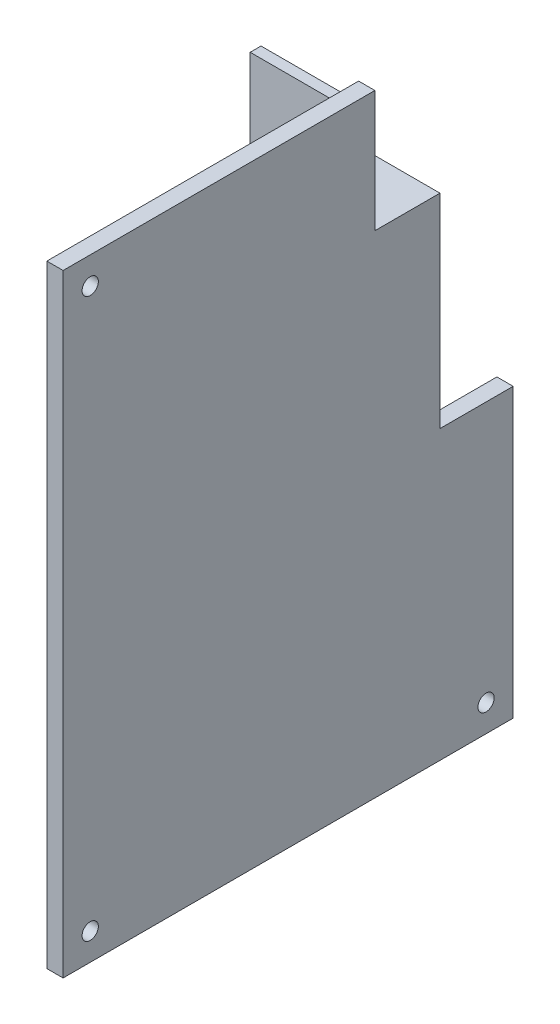
from build123d import *

# Parameters (mm, degrees)
SKETCH1_R                       = 1.5
BOSS_EXTRUDE1_DEPTH             = 3
BOSS_EXTRUDE2_DEPTH             = 18
BOSS_EXTRUDE2_DIRECTION_2_REACH = 78.19


with BuildPart() as part:
    # Sketch1 → Boss-Extrude1 (new body)
    with BuildSketch(Plane.YZ):
        Polygon((-9.054273726, -23.394917756), (28.546051212, -23.394917756), (28.546051212, -13.394917756), (47.945726274, -13.394917756), (50.945726274, -13.394917756), (50.945726274, 44.105082244), (-62.054273726, 44.105082244), (-62.054273726, -38.894917756), (-9.054273726, -38.894917756), align=None)
        with Locations(Location((-57.054273726, -33.894917756, 0), (0, 0, 270))):
            Circle(SKETCH1_R, mode=Mode.SUBTRACT)
        with Locations(Location((-57.054273726, 39.105082244, 0), (0, 0, 270))):
            Circle(SKETCH1_R, mode=Mode.SUBTRACT)
        with Locations(Location((45.945726274, 39.105082244, 0), (0, 0, 270))):
            Circle(SKETCH1_R, mode=Mode.SUBTRACT)
    extrude(amount=BOSS_EXTRUDE1_DEPTH)

    # Sketch2 → Boss-Extrude2 (add)
    with BuildSketch(Plane(origin=(0, 0, 0), x_dir=(0, -1, 0), z_dir=(-1, 0, 0))):
        Polygon((9.054273726, -23.394917756), (9.054273726, -25.394917756), (-28.546051212, -25.394917756), (-28.546051212, -23.394917756), (-28.546051212, -13.394917756), (-47.545726274, -13.394917756), (-47.545726274, -11.394917756), (-26.545726274, -11.394917756), (-26.545726274, -23.394917756), align=None)
    extrude(amount=BOSS_EXTRUDE2_DEPTH)

    # Boss-Extrude2 direction 2: up to this face of the body (flat: up to its plane)
    boss_extrude2_direction_2_end = Plane(part.part.faces().sort_by_distance((3, -9.750873795, 6.972989725))[0])
    # Sketch2 → Boss-Extrude2 direction 2 (add, up to the picked face)
    with BuildSketch(Plane(origin=(0, 0, 0), x_dir=(0, -1, 0), z_dir=(-1, 0, 0)), mode=Mode.PRIVATE) as boss_extrude2_direction_2_sk1:
        Polygon((9.054273726, -23.394917756), (9.054273726, -25.394917756), (-28.546051212, -25.394917756), (-28.546051212, -23.394917756), (-28.546051212, -13.394917756), (-47.545726274, -13.394917756), (-47.545726274, -11.394917756), (-26.545726274, -11.394917756), (-26.545726274, -23.394917756), align=None)
    boss_extrude2_direction_2_tool1 = split(extrude(boss_extrude2_direction_2_sk1.sketch, amount=-BOSS_EXTRUDE2_DIRECTION_2_REACH, mode=Mode.PRIVATE), bisect_by=boss_extrude2_direction_2_end, keep=Keep.BOTH, mode=Mode.PRIVATE)
    add(boss_extrude2_direction_2_tool1.solids().sort_by(Axis((0, -8.471216, -24.394918), (1, 0, 0)))[0])


solid = part.part
